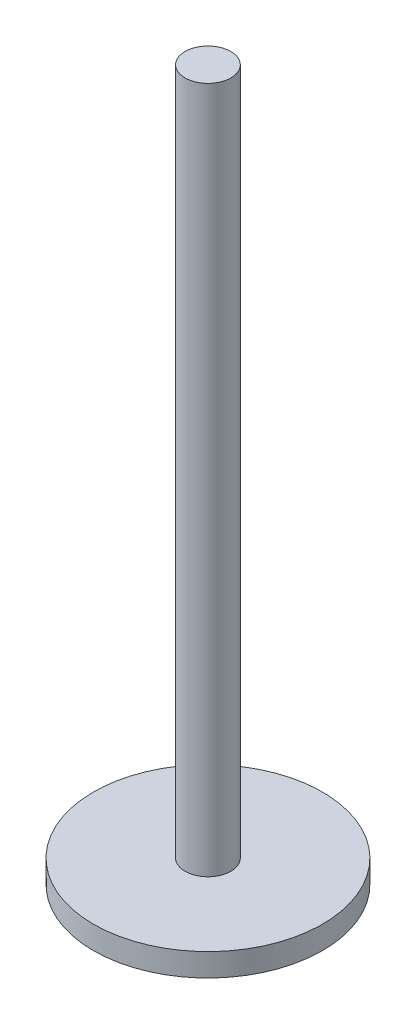
from build123d import *

# Parameters (mm, degrees)
SKETCH1_R           = 2
BOSS_EXTRUDE1_DEPTH = 0.4
SKETCH1_3_R         = 0.4
BOSS_EXTRUDE2_DEPTH = 12


with BuildPart() as part:
    # Sketch1 → Boss-Extrude1 (new body)
    with BuildSketch(Plane(origin=(0, 0, 0), x_dir=(1, 0, 0), z_dir=(0, 1, 0))):
        Circle(SKETCH1_R)
    extrude(amount=-BOSS_EXTRUDE1_DEPTH)

    # Sketch1<3> → Boss-Extrude2 (add)
    with BuildSketch(Plane(origin=(0, 0, 0), x_dir=(1, 0, 0), z_dir=(0, 1, 0))):
        Circle(SKETCH1_3_R)
    extrude(amount=BOSS_EXTRUDE2_DEPTH)


solid = part.part
